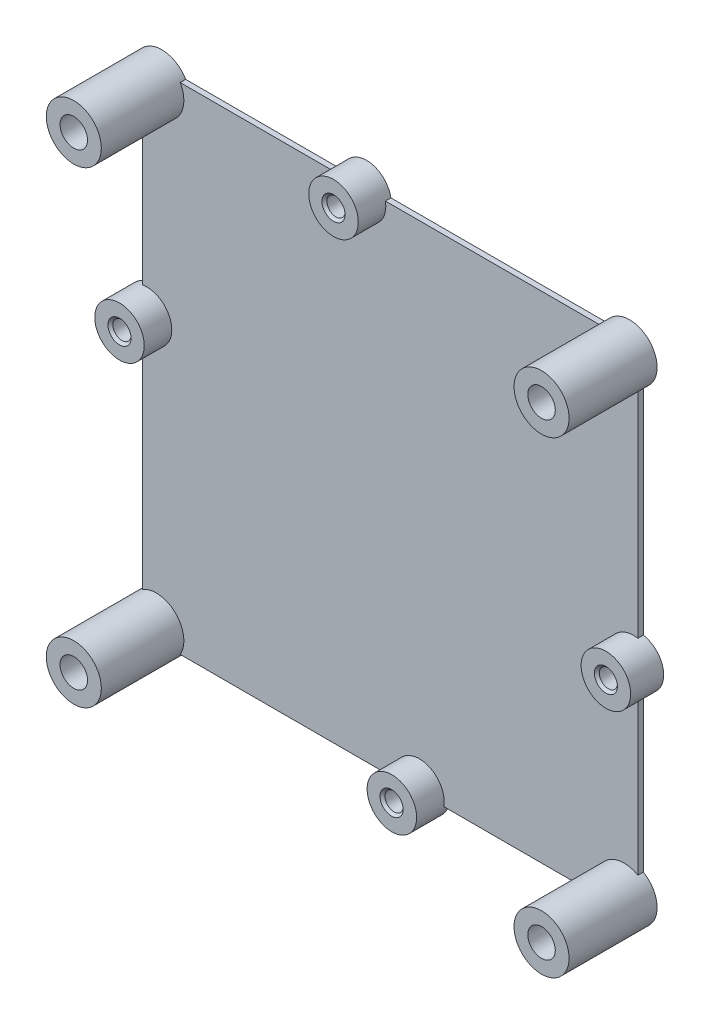
from build123d import *

# Parameters (mm, degrees)
SKIZZE1_W                                            = 90
SKIZZE1_H                                            = 90
AUFSATZ_LINEAR_AUSTRAGEN1_DEPTH                      = 1
AUFSATZ_LINEAR_START                                 = -1
SKIZZE12_R                                           = 5
AUFSATZ_LINEAR_AUSTRAGEN2_DEPTH                      = 16
SKIZZE13_R                                           = 2.5
SCHNITT_LINEAR_AUSTRAGEN6_DEPTH                      = 100
LINEARES_MUSTER1_COUNT                               = 2
LINEARES_MUSTER1_PITCH                               = 85
LINEARES_MUSTER1_COUNT_DIR2                          = 2
LINEARES_MUSTER1_PITCH_DIR2                          = 85
AUFSATZ_LINEAR_AUSTRAGEN3_DEPTH                      = 5
AUFSATZ_LINEAR_AUSTRAGEN3_DEPTH_BACK                 = 1
SKIZZE16_R                                           = 4.5
FORMSENKUNG_F_R_M3_LINSENSENKSCHRAUBE_MI_D           = 3.3
FORMSENKUNG_F_R_M3_LINSENSENKSCHRAUBE_MI_DEPTH       = 20
FORMSENKUNG_F_R_M3_LINSENSENKSCHRAUBE_MI_CSINK_D     = 4.2
FORMSENKUNG_F_R_M3_LINSENSENKSCHRAUBE_MI_CSINK_ANGLE = 90
FORMSENKUNG_F_R_M3_LINSENSENKSCHRAUBE_MI_TIP         = 0.991420021


with BuildPart() as part:
    # Skizze1 → Aufsatz-Linear austragen1 (new body)
    with BuildSketch(Plane.XY):
        Rectangle(SKIZZE1_W, SKIZZE1_H)
    extrude(amount=AUFSATZ_LINEAR_AUSTRAGEN1_DEPTH)

    # Skizze12 → Aufsatz-Linear austragen2 (add)
    with BuildSketch(Plane.XY.offset(1).offset(AUFSATZ_LINEAR_START)):
        with Locations((-42.5, 42.5)):
            Circle(SKIZZE12_R)
    aufsatz_linear_austragen2 = extrude(amount=AUFSATZ_LINEAR_AUSTRAGEN2_DEPTH)

    # Skizze13 → Schnitt-Linear austragen6 (cut)
    with BuildSketch(Plane.XY.offset(16)):
        with Locations((-42.5, 42.5)):
            Circle(SKIZZE13_R)
    schnitt_linear_austragen6 = extrude(amount=-SCHNITT_LINEAR_AUSTRAGEN6_DEPTH, mode=Mode.SUBTRACT)

    # Lineares Muster1: Aufsatz-Linear austragen2, Schnitt-Linear austragen6 2 × 2
    with Locations(*[(i * LINEARES_MUSTER1_PITCH, -j * LINEARES_MUSTER1_PITCH_DIR2, 0) for i in range(LINEARES_MUSTER1_COUNT) for j in range(LINEARES_MUSTER1_COUNT_DIR2) if (i, j) != (0, 0)]):
        add(aufsatz_linear_austragen2)
        add(schnitt_linear_austragen6, mode=Mode.SUBTRACT)

    # Skizze16 → Aufsatz-Linear austragen3 (add, two sides: drawn at the far end of the back side and taken through both)
    with BuildSketch(Plane.XY.offset(1).offset(-AUFSATZ_LINEAR_AUSTRAGEN3_DEPTH_BACK)):
        with Locations((44.194173824, -5.303300859)):
            Circle(SKIZZE16_R)
        with Locations((5.303300859, -44.194173824)):
            Circle(SKIZZE16_R)
        with Locations((-44.194173824, 5.303300859)):
            Circle(SKIZZE16_R)
        with Locations((-5.303300859, 44.194173824)):
            Circle(SKIZZE16_R)
    extrude(amount=AUFSATZ_LINEAR_AUSTRAGEN3_DEPTH + AUFSATZ_LINEAR_AUSTRAGEN3_DEPTH_BACK)

    # Formsenkung für M3 Linsensenkschraube mit Schlitz1
    with Locations(Plane.XY.offset(6)):
        with Locations((5.243612969, -44.154400898), (44.194173824, -5.303300859), (-5.303300859, 44.194173824), (-44.194173824, 5.303300859)):
            CounterSinkHole(FORMSENKUNG_F_R_M3_LINSENSENKSCHRAUBE_MI_D / 2, FORMSENKUNG_F_R_M3_LINSENSENKSCHRAUBE_MI_CSINK_D / 2, depth=FORMSENKUNG_F_R_M3_LINSENSENKSCHRAUBE_MI_DEPTH, counter_sink_angle=FORMSENKUNG_F_R_M3_LINSENSENKSCHRAUBE_MI_CSINK_ANGLE)
            with Locations((0, 0, -(FORMSENKUNG_F_R_M3_LINSENSENKSCHRAUBE_MI_DEPTH + FORMSENKUNG_F_R_M3_LINSENSENKSCHRAUBE_MI_TIP / 2))):  # 118° drill point
                Cone(0, FORMSENKUNG_F_R_M3_LINSENSENKSCHRAUBE_MI_D / 2, FORMSENKUNG_F_R_M3_LINSENSENKSCHRAUBE_MI_TIP, mode=Mode.SUBTRACT)


solid = part.part
